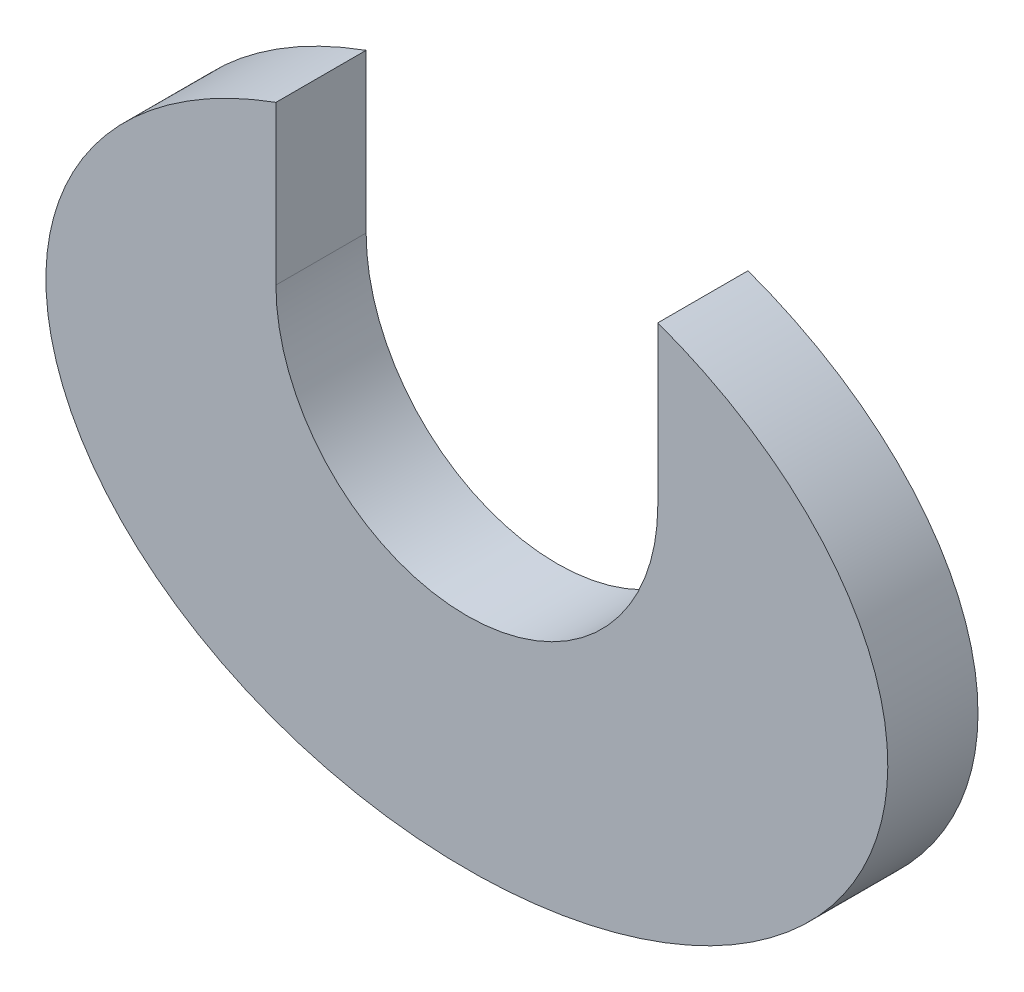
from build123d import *

# Parameters (mm, degrees)
SKETCH1_RX          = 14
SKETCH1_RY          = 10
RING_EXTRUDE_DEPTH  = 1.5
SPAR_CUT_DEPTH      = 18.464249197
SPAR_CUT_DEPTH_BACK = 18.464249197


with BuildPart() as part:
    # Sketch1 → Ring extrude (new, symmetric)
    with BuildSketch(Plane.XY):
        with Locations((0, 0)):
            Ellipse(SKETCH1_RX, SKETCH1_RY)
    extrude(amount=RING_EXTRUDE_DEPTH, both=True)

    # Sketch2 → Spar cut (cut, two sides: drawn at the far end of the back side and taken through both)
    with BuildSketch(Plane.XY.offset(1.5).offset(-SPAR_CUT_DEPTH_BACK)):
        with BuildLine():
            Line((-6.35, 3.65), (-6.35, 8.912199275))
            add(Edge.make_bspline(
                [(6.35, 8.912199275), (0, 11.220574957), (-6.35, 8.912199275)],
                knots=[1.100027707, 1.100027707, 1.100027707, 2.041564947, 2.041564947, 2.041564947], degree=2, weights=[1, 0.891219928, 1]))
            Line((6.35, 8.912199275), (6.35, 3.65))
            ThreePointArc((6.35, 3.65), (0, -2.7), (-6.35, 3.65))
        make_face()
    extrude(amount=SPAR_CUT_DEPTH + SPAR_CUT_DEPTH_BACK, mode=Mode.SUBTRACT)


solid = part.part
